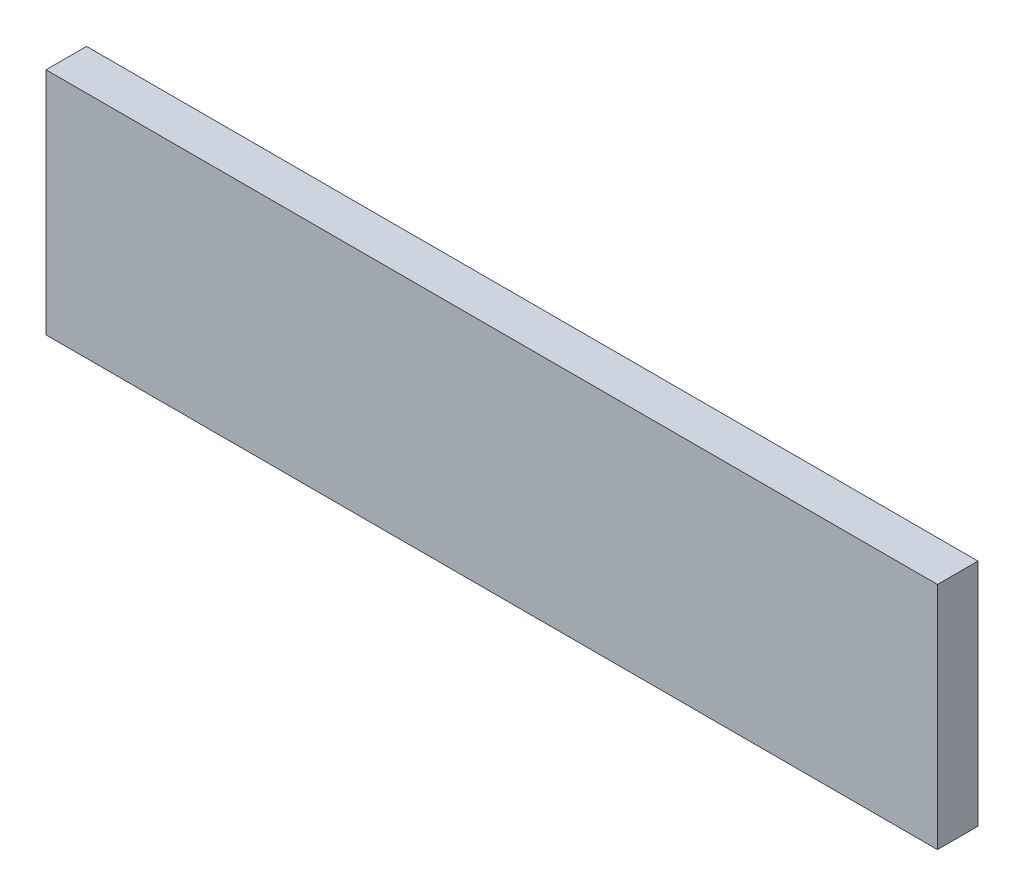
from build123d import *

# Parameters (mm, degrees)
ESBO_O1_W                = 330
ESBO_O1_H                = 85
RESSALTO_EXTRUS_O1_DEPTH = 15


with BuildPart() as part:
    # Esboço1 → Ressalto-extrusão1 (new body)
    with BuildSketch(Plane.XY):
        Rectangle(ESBO_O1_W, ESBO_O1_H)
    extrude(amount=RESSALTO_EXTRUS_O1_DEPTH)


solid = part.part
